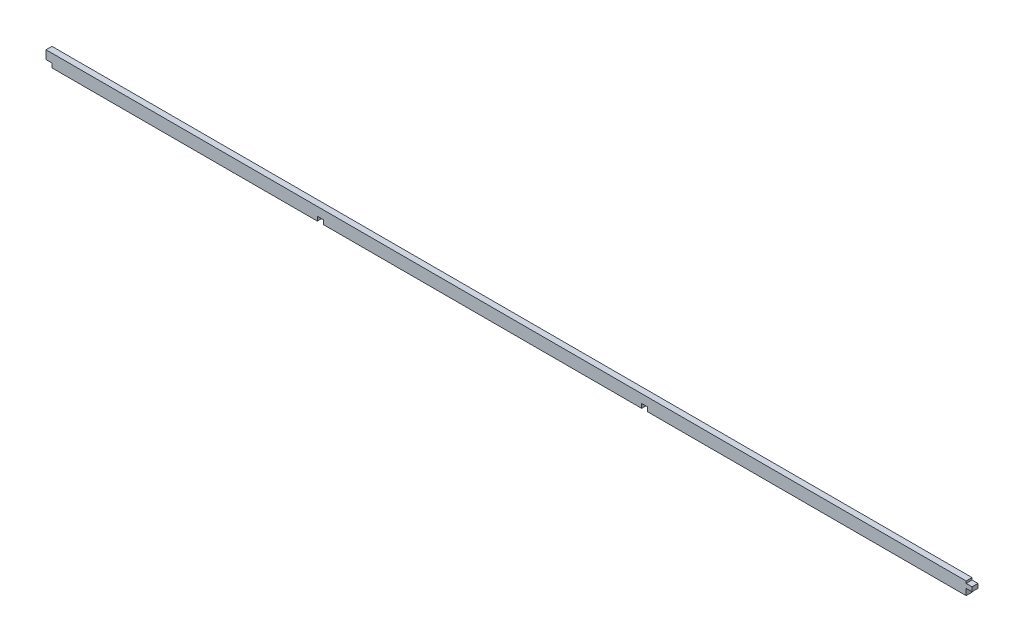
from build123d import *

# Parameters (mm, degrees)
EXTRUDE_1_DEPTH = 1.4


with BuildPart() as part:
    # Эскиз1 → Бобышка-Вытянуть1 (new, symmetric)
    with BuildSketch(Plane.XY):
        Polygon((0, -4), (2.8, -4), (2.8, -6), (127.8, -6), (127.8, -4), (130.6, -4), (130.6, -6), (280.6, -6), (280.6, -4), (283.4, -4), (283.4, -6), (433.4, -6), (433.4, -3), (436.2, -3), (436.2, -1), (433.4, -1), (433.4, 0), (0, 0), align=None)
    extrude(amount=EXTRUDE_1_DEPTH, both=True)


solid = part.part
